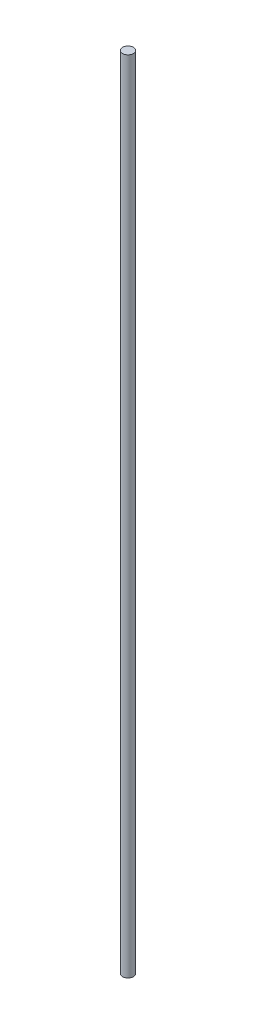
from build123d import *

# Parameters (mm, degrees)
SKETCH_1_R      = 4
EXTRUDE_1_DEPTH = 590


with BuildPart() as part:
    # 草图1 → 凸台-拉伸1 (new body)
    with BuildSketch(Plane(origin=(0, 0, 0), x_dir=(1, 0, 0), z_dir=(0, 1, 0))):
        with Locations(Location((0, 0, 0), (0, 0, 270))):
            Circle(SKETCH_1_R)
    extrude(amount=EXTRUDE_1_DEPTH)


solid = part.part
